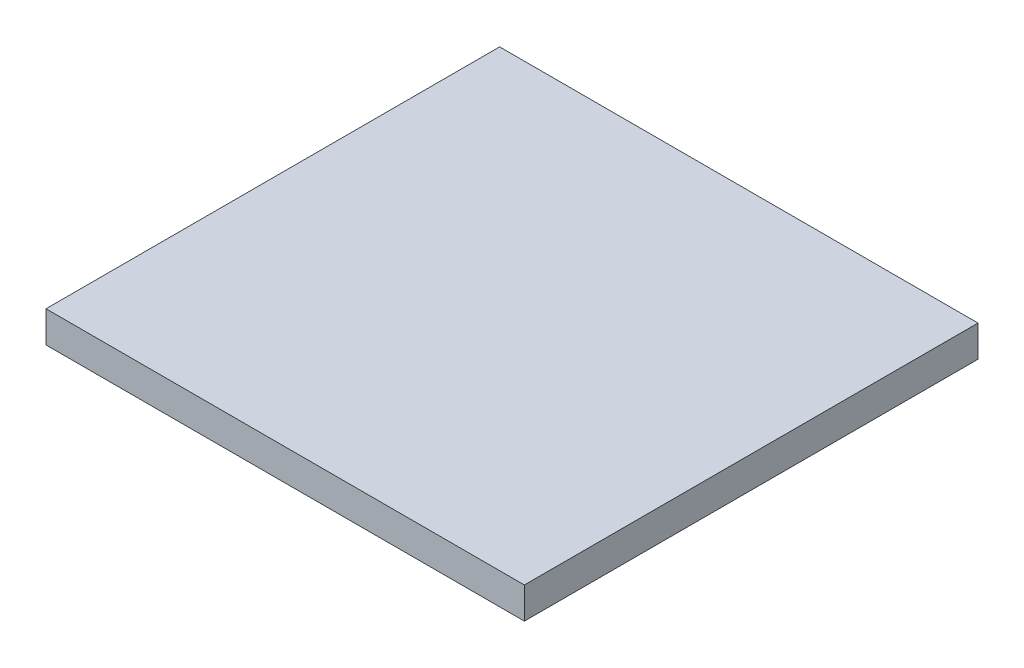
from build123d import *

# Parameters (mm, degrees)
OVEN_SICAK_DOLAP_PU_UST_1_START = -30
SKETCH1_W                       = 580
SKETCH1_H                       = 38
OVEN_SICAK_DOLAP_PU_UST_1_DEPTH = 550


with BuildPart() as part:
    # Sketch1 → OVEN_sicak_dolap_pu_ust_1 (new body)
    with BuildSketch(Plane.XY.offset(OVEN_SICAK_DOLAP_PU_UST_1_START)):
        with Locations((350, 1099)):
            Rectangle(SKETCH1_W, SKETCH1_H)
    extrude(amount=-OVEN_SICAK_DOLAP_PU_UST_1_DEPTH)


solid = part.part
